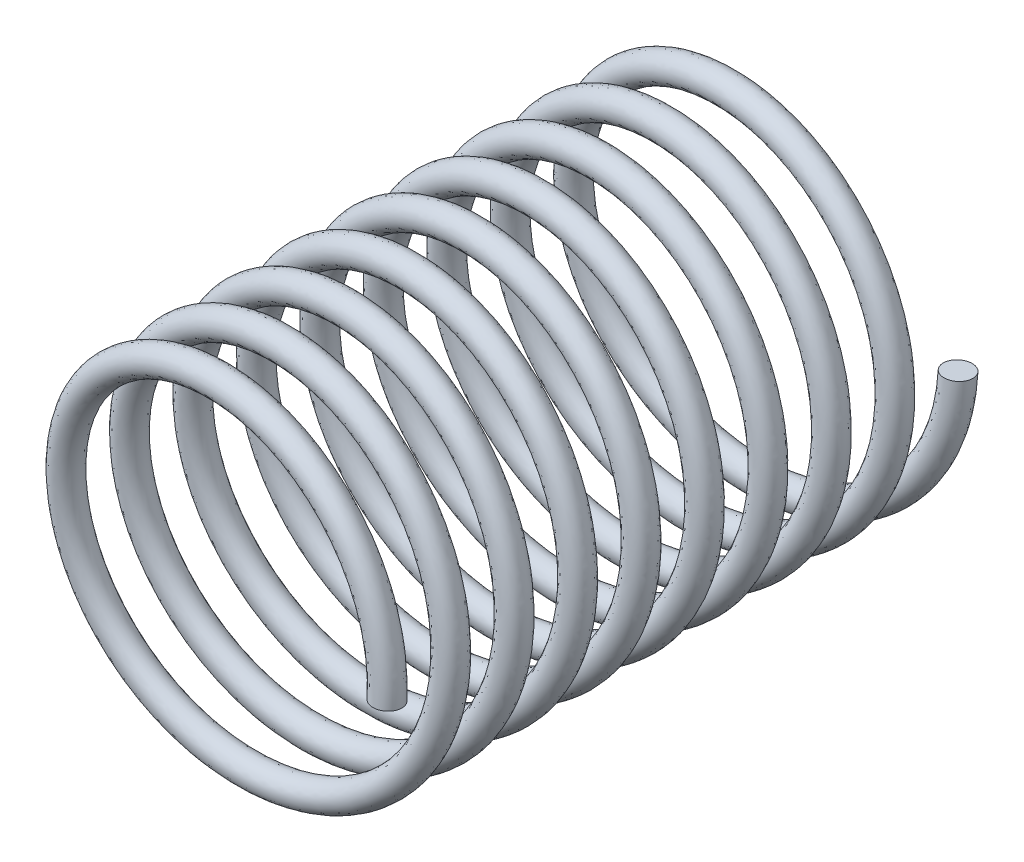
from build123d import *

# Parameters (mm, degrees)
SWEEP1_PITCH  = 9
SWEEP1_HEIGHT = 81
SWEEP1_RADIUS = 25
SKETCH3_R     = 2


with BuildPart() as part:
    # Sweep1: sweep along a helix
    with BuildLine() as sweep1_path:
        Helix(SWEEP1_PITCH, SWEEP1_HEIGHT, SWEEP1_RADIUS, center=(0, 0, 0), direction=(0, 0, 1), lefthand=True)
    # Sketch3 → Sweep1 (sweep)
    with BuildSketch(Plane(origin=(25, 0, 81), x_dir=(-1, 0, 0), z_dir=(-1.2621656405885473e-13, -0.9983626271075428, 0.05720196495685971))):
        Circle(SKETCH3_R)
    sweep(path=sweep1_path.line, is_frenet=True)


solid = part.part
